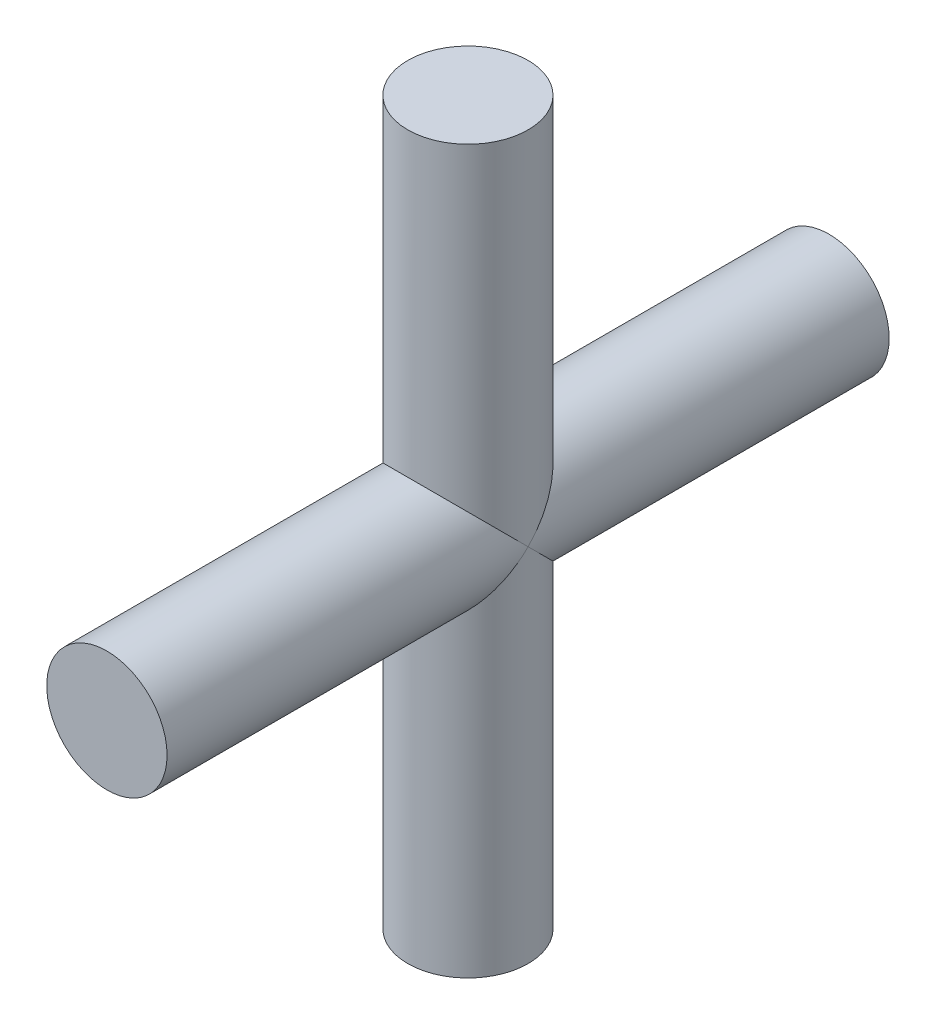
from build123d import *

# Parameters (mm, degrees)
SKETCH1_W                = 1.016
SKETCH1_H                = 6.096
BOSS_EXTRUDE1_DEPTH      = 6.096
BOSS_EXTRUDE1_DEPTH_BACK = 6.096
SKETCH2_R                = 1.016
BOSS_EXTRUDE2_START      = 6.096
SKETCH3_R                = 1.016
BOSS_EXTRUDE2_DEPTH      = 6.096


with BuildPart() as part:
    # Sketch1 → Revolve2 (revolve)
    with BuildSketch(Plane(origin=(0, 0, 0), x_dir=(1, 0, 0), z_dir=(0, 1, 0))):
        with Locations((-0.508, 3.048)):
            Rectangle(SKETCH1_W, SKETCH1_H)
    revolve(axis=Axis((0, 0, 0), (0, 0, -1)))

    # Sketch2 → Boss-Extrude1 (add, two sides: drawn at the far end of the back side and taken through both)
    with BuildSketch(Plane(origin=(0, 0, 0), x_dir=(1, 0, 0), z_dir=(0, 1, 0)).offset(-BOSS_EXTRUDE1_DEPTH_BACK)):
        Circle(SKETCH2_R)
    extrude(amount=BOSS_EXTRUDE1_DEPTH + BOSS_EXTRUDE1_DEPTH_BACK)

    # Sketch3 → Boss-Extrude2 (add)
    with BuildSketch(Plane.XY.offset(BOSS_EXTRUDE2_START)):
        Circle(SKETCH3_R)
    extrude(amount=-BOSS_EXTRUDE2_DEPTH)


solid = part.part
